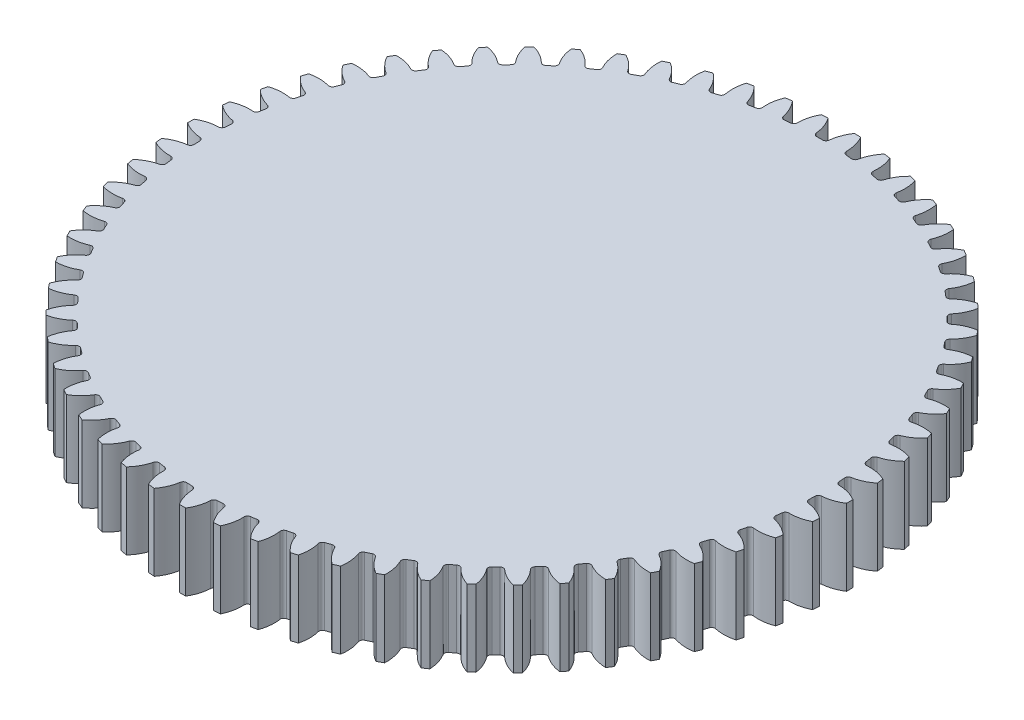
from build123d import *

# Parameters (mm, degrees)
MAIN_BODY_R              = 21.6
MAIN_BODY_EXTRUDE_DEPTH  = 2.5
CUT_EXTRUDE1_DEPTH       = 31.649143544
FILLET1_R                = 0.228
CIRPATTERN2_COUNT        = 63
FILLET1_OF_CIRPATTERN2_R = 0.228


with BuildPart() as part:
    # Main Body → Main Body Extrude (new, symmetric)
    with BuildSketch(Plane(origin=(0, 0, 0), x_dir=(1, 0, 0), z_dir=(0, 1, 0))):
        with Locations(Location((0, 0, 0), (0, 0, 270))):
            Circle(MAIN_BODY_R)
    extrude(amount=MAIN_BODY_EXTRUDE_DEPTH, both=True)

    # Sketch5 → Cut-Extrude1 (cut, symmetric)
    with BuildSketch(Plane(origin=(0, 0, 0), x_dir=(1, 0, 0), z_dir=(0, 1, 0))):
        with BuildLine():
            ThreePointArc((0.866331455, 21.582619623), (0, 21.6), (-0.866331455, 21.582619623))
            ThreePointArc((-0.866331455, 21.582619623), (-0.530518898, 20.903274293), (-0.404982266, 20.155931865))
            ThreePointArc((-0.404982266, 20.155931865), (0, 20.16), (0.404982266, 20.155931865))
            ThreePointArc((0.404982266, 20.155931865), (0.530518898, 20.903274293), (0.866331455, 21.582619623))
        make_face()
    cut_extrude1 = extrude(amount=CUT_EXTRUDE1_DEPTH, both=True, mode=Mode.SUBTRACT)

    # Fillet1
    fillet1_edges = [part.edges().sort_by_distance(p)[0] for p in [
        (-0.404982266, 0, -20.155931865),
        (0.404982266, 0, -20.155931865),
    ]]
    fillet(fillet1_edges, radius=FILLET1_R)

    # CirPattern2: Cut-Extrude1 ×63 about axis
    cirpattern2_axis = Axis((0, 0, 0), (0, 1, 0))
    for i in range(1, CIRPATTERN2_COUNT):
        add(cut_extrude1.rotate(cirpattern2_axis, i * 360 / CIRPATTERN2_COUNT), mode=Mode.SUBTRACT)

    # Fillet1 of CirPattern2
    fillet1_of_cirpattern2_edges = [part.edges().sort_by_distance(p)[0] for p in [
        (-2.40985255, 0, -20.0154493),
        (-1.603912914, 0, -20.096095724),
        (-4.390772636, 0, -19.676044207),
        (-3.596867687, 0, -19.836535555),
        (-6.328055252, 0, -19.141089748),
        (-5.554075173, 0, -19.379830984),
        (-8.202446812, 0, -18.415902538),
        (-7.456083764, 0, -18.730520946),
        (-9.99531877, 0, -17.507689816),
        (-9.283990445, 0, -17.895058575),
        (-11.688852759, 0, -16.425477806),
        (-11.019628658, 0, -16.881747073),
        (-13.266217679, 0, -15.180022019),
        (-12.645748851, 0, -15.700657184),
        (-14.711736967, 0, -13.783700353),
        (-14.14618991, 0, -14.36352711),
        (-16.011044403, 0, -12.25039008),
        (-15.506039778, 0, -12.88364585),
        (-17.151226887, 0, -10.595329927),
        (-16.711783657, 0, -11.27572113),
        (-18.120952773, 0, -8.834968625),
        (-17.751438322, 0, -9.555733227),
        (-18.910584489, 0, -6.986801435),
        (-18.614671217, 0, -7.740776154),
        (-19.51227432, 0, -5.069196274),
        (-19.292903147, 0, -5.848887771),
        (-19.920042403, 0, -3.101211163),
        (-19.779393538, 0, -3.898870513),
        (-20.129836155, 0, -1.102404822),
        (-20.069307429, 0, -1.910104528),
        (-20.139570551, 0, 0.907357714),
        (-20.159763527, 0, 0.097644934),
        (-19.949148847, 0, 2.908102521),
        (-20.049862838, 0, 2.104423957),
        (-19.56046354, 0, 4.879945298),
        (-19.740697604, 0, 4.090288269),
        (-18.977377558, 0, 6.803288987),
        (-19.235340448, 0, 6.035501458),
        (-18.205685871, 0, 8.659018533),
        (-18.538813837, 0, 7.920731123),
        (-17.2530579, 0, 10.428690863),
        (-17.658040165, 0, 9.727241003),
        (-16.128961287, 0, 12.094718177),
        (-16.601772957, 0, 11.437077191),
        (-14.844567811, 0, 13.640542749),
        (-15.380509871, 0, 13.033246569),
        (-13.412642351, 0, 15.050801479),
        (-14.006388367, 0, 14.499885686),
        (-11.847416026, 0, 16.311478581),
        (-12.493065083, 0, 15.822418425),
        (-10.164444757, 0, 17.410044882),
        (-10.855580106, 0, 16.987700862),
        (-8.38045467, 0, 18.335582334),
        (-9.110207496, 0, 17.984151895),
        (-6.513175859, 0, 19.078892532),
        (-7.274293552, 0, 18.801868347),
        (-4.58116618, 0, 19.632588124),
        (-5.36608441, 0, 19.432723384),
        (-2.603626814, 0, 19.991166234),
        (-3.40454471, 0, 19.870447285),
        (-0.600211434, 0, 20.151063154),
        (-1.409169116, 0, 20.110689755),
        (1.409169116, 0, 20.110689755),
        (0.600211434, 0, 20.151063154),
        (3.40454471, 0, 19.870447285),
        (2.603626814, 0, 19.991166234),
        (5.36608441, 0, 19.432723384),
        (4.58116618, 0, 19.632588124),
        (7.274293552, 0, 18.801868347),
        (6.513175859, 0, 19.078892532),
        (9.110207496, 0, 17.984151895),
        (8.38045467, 0, 18.335582334),
        (10.855580106, 0, 16.987700862),
        (10.164444757, 0, 17.410044882),
        (12.493065083, 0, 15.822418425),
        (11.847416026, 0, 16.311478581),
        (14.006388367, 0, 14.499885686),
        (13.412642351, 0, 15.050801479),
        (15.380509871, 0, 13.033246569),
        (14.844567811, 0, 13.640542749),
        (16.601772957, 0, 11.437077191),
        (16.128961287, 0, 12.094718177),
        (17.658040165, 0, 9.727241003),
        (17.2530579, 0, 10.428690863),
        (18.538813837, 0, 7.920731123),
        (18.205685871, 0, 8.659018533),
        (19.235340448, 0, 6.035501458),
        (18.977377558, 0, 6.803288987),
        (19.740697604, 0, 4.090288269),
        (19.56046354, 0, 4.879945298),
        (20.049862838, 0, 2.104423957),
        (19.949148847, 0, 2.908102521),
        (20.159763527, 0, 0.097644934),
        (20.139570551, 0, 0.907357714),
        (20.069307429, 0, -1.910104528),
        (20.129836155, 0, -1.102404822),
        (19.779393538, 0, -3.898870513),
        (19.920042403, 0, -3.101211163),
        (19.292903147, 0, -5.848887771),
        (19.51227432, 0, -5.069196274),
        (18.614671217, 0, -7.740776154),
        (18.910584489, 0, -6.986801435),
        (17.751438322, 0, -9.555733227),
        (18.120952773, 0, -8.834968625),
        (16.711783657, 0, -11.27572113),
        (17.151226887, 0, -10.595329927),
        (15.506039778, 0, -12.88364585),
        (16.011044403, 0, -12.25039008),
        (14.14618991, 0, -14.36352711),
        (14.711736967, 0, -13.783700353),
        (12.645748851, 0, -15.700657184),
        (13.266217679, 0, -15.180022019),
        (11.019628658, 0, -16.881747073),
        (11.688852759, 0, -16.425477806),
        (9.283990445, 0, -17.895058575),
        (9.99531877, 0, -17.507689816),
        (7.456083764, 0, -18.730520946),
        (8.202446812, 0, -18.415902538),
        (5.554075173, 0, -19.379830984),
        (6.328055252, 0, -19.141089748),
        (3.596867687, 0, -19.836535555),
        (4.390772636, 0, -19.676044207),
        (1.603912914, 0, -20.096095724),
        (2.40985255, 0, -20.0154493),
    ]]
    fillet(fillet1_of_cirpattern2_edges, radius=FILLET1_OF_CIRPATTERN2_R)


solid = part.part
